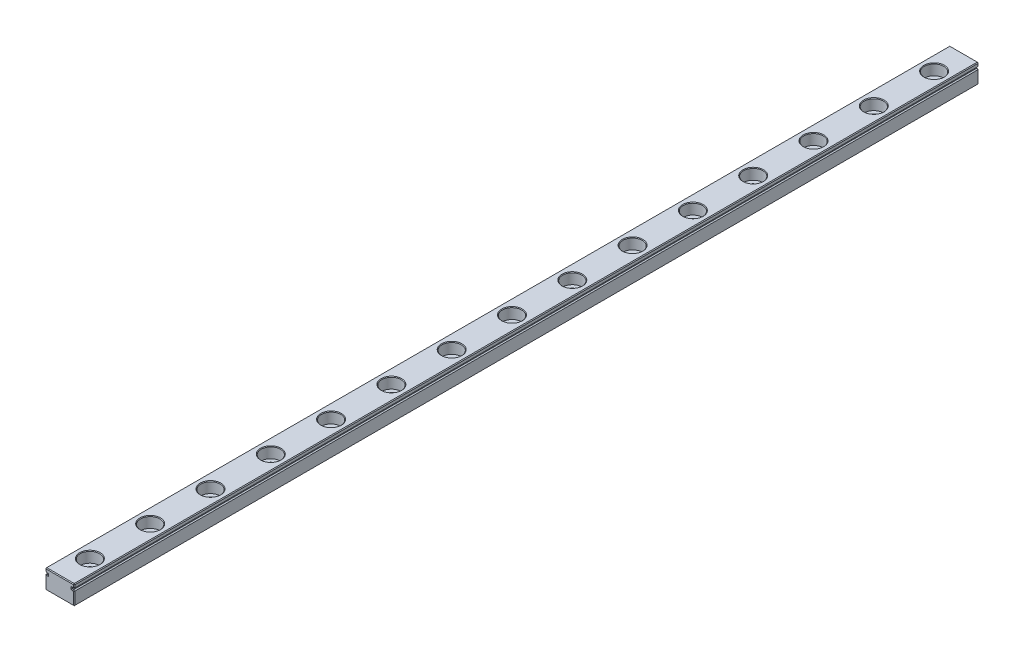
from build123d import *

# Parameters (mm, degrees)
BOSS_EXTRUDE1_DEPTH = 375
CHAMFER1_SIZE       = 0.3
LPATTERN1_COUNT     = 15
LPATTERN1_PITCH     = 25


with BuildPart() as part:
    # Sketch1 → Boss-Extrude1 (new body)
    with BuildSketch(Plane.XY):
        with BuildLine():
            Line((0, 8), (12, 8))
            Line((12, 8), (12, 6.75))
            Line((12, 6.75), (12, 6.559016994))
            ThreePointArc((12, 6.559016994), (11.706107374, 6.475528258), (11.5, 6.25))
            Line((11.5, 6.25), (11, 6.25))
            Line((11, 6.25), (11, 5.75))
            Line((11, 5.75), (11.5, 5.75))
            ThreePointArc((11.5, 5.75), (11.706107374, 5.524471742), (12, 5.440983006))
            Line((12, 5.440983006), (12, 5.25))
            Line((12, 5.25), (12, 0))
            Line((12, 0), (0, 0))
            Line((0, 0), (0, 5.25))
            Line((0, 5.25), (0, 5.440983006))
            ThreePointArc((0, 5.440983006), (0.293892626, 5.524471742), (0.5, 5.75))
            Line((0.5, 5.75), (1, 5.75))
            Line((1, 5.75), (1, 6.25))
            Line((1, 6.25), (0.5, 6.25))
            ThreePointArc((0.5, 6.25), (0.293892626, 6.475528258), (0, 6.559016994))
            Line((0, 6.559016994), (0, 6.75))
            Line((0, 6.75), (0, 8))
        make_face()
    extrude(amount=BOSS_EXTRUDE1_DEPTH)

    # Chamfer1
    chamfer1_edges = [part.edges().sort_by_distance(p)[0] for p in [
        (12, 2.720491503, 375),
        (11.706107374, 5.524471742, 375),
        (0, 2.720491503, 0),
        (0.293892626, 5.524471742, 0),
        (0.75, 5.75, 0),
        (1, 6, 0),
        (0.75, 6.25, 0),
        (11.25, 5.75, 375),
        (0.293892626, 6.475528258, 0),
        (0, 7.279508497, 0),
        (6, 8, 0),
        (12, 7.279508497, 0),
        (11.706107374, 6.475528258, 0),
        (11, 6, 375),
        (11.25, 6.25, 0),
        (11, 6, 0),
        (11.25, 5.75, 0),
        (11.706107374, 5.524471742, 0),
        (12, 2.720491503, 0),
        (6, 0, 0),
        (11.25, 6.25, 375),
        (11.706107374, 6.475528258, 375),
        (12, 7.279508497, 375),
        (0, 8, 187.5),
        (12, 8, 187.5),
        (12, 0, 187.5),
        (0, 0, 187.5),
        (6, 8, 375),
        (0, 2.720491503, 375),
        (0, 7.279508497, 375),
        (0.293892626, 6.475528258, 375),
        (0.75, 6.25, 375),
        (1, 6, 375),
        (0.75, 5.75, 375),
        (0.293892626, 5.524471742, 375),
        (6, 0, 375),
    ]]
    chamfer(chamfer1_edges, length=CHAMFER1_SIZE)

    # Sketch3 → CBORE for M5 Hex Head Bolt1 (revolve, cut)
    with BuildSketch(Plane(origin=(6, 8, 12.5), x_dir=(0, 0, 1), z_dir=(1, 0, 0))):
        Polygon((0, 0), (0, 8), (2.5, 8), (2.25, 7.75), (2.25, 4.5), (4, 4.5), (4, 0.25), (4.25, 0), align=None)
    cbore_for_m5_hex_head_bolt1 = revolve(axis=Axis((6, 14.35, 12.5), (0, -1, 0)), mode=Mode.SUBTRACT)

    # LPattern1: CBORE for M5 Hex Head Bolt1 ×15
    with Locations(*[(0, 0, i * LPATTERN1_PITCH) for i in range(1, LPATTERN1_COUNT)]):
        add(cbore_for_m5_hex_head_bolt1, mode=Mode.SUBTRACT)


solid = part.part
